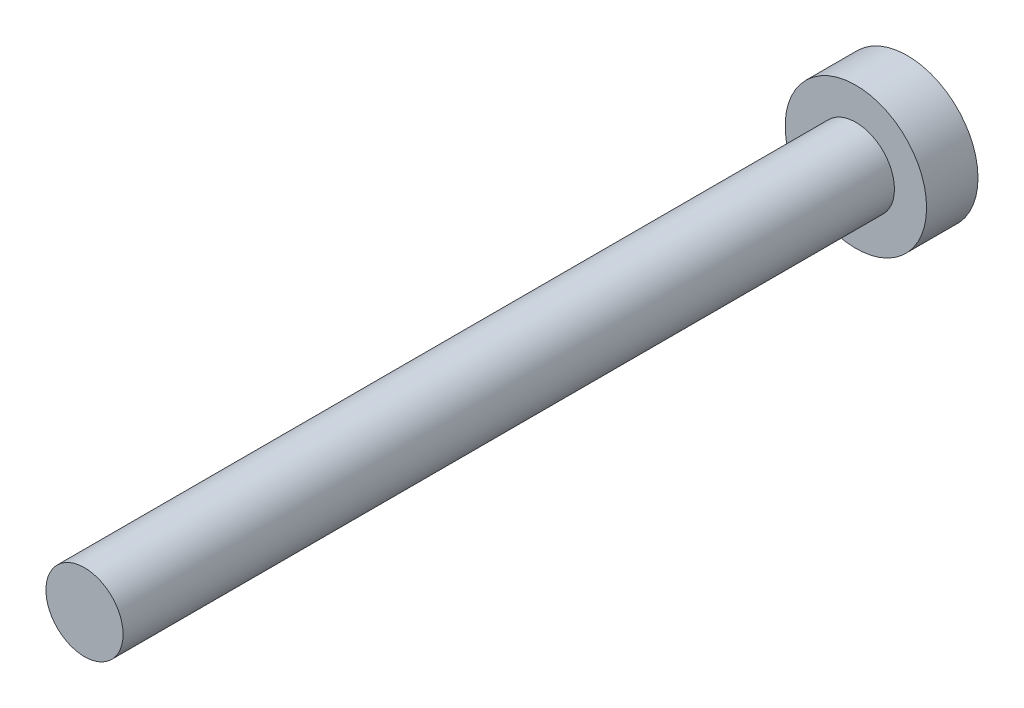
from build123d import *

# Parameters (mm, degrees)
ESQUISSE1_R        = 2.75
BOSS_EXTRU_1_DEPTH = 2
ESQUISSE2_R        = 1.5
BOSS_EXTRU_2_DEPTH = 30


with BuildPart() as part:
    # Esquisse1 → Boss.-Extru.1 (new body)
    with BuildSketch(Plane.XY):
        Circle(ESQUISSE1_R)
    extrude(amount=BOSS_EXTRU_1_DEPTH)

    # Esquisse2 → Boss.-Extru.2 (add)
    with BuildSketch(Plane.XY.offset(2)):
        Circle(ESQUISSE2_R)
    extrude(amount=BOSS_EXTRU_2_DEPTH)


solid = part.part
